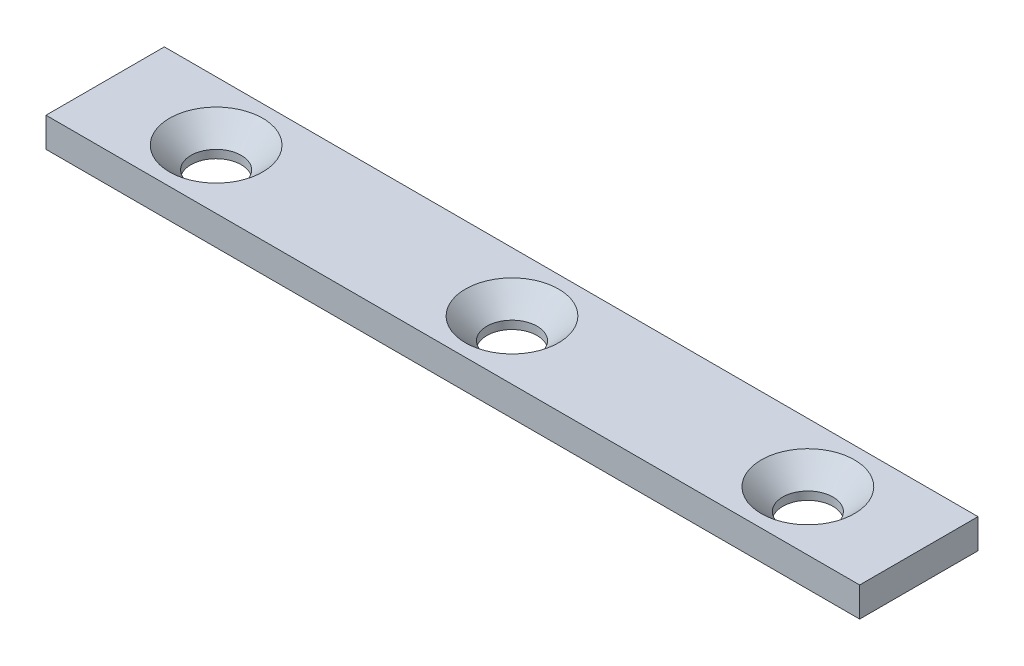
from build123d import *

# Parameters (mm, degrees)
SKETCH1_W           = 55
SKETCH1_H           = 8
BOSS_EXTRUDE1_DEPTH = 2
LPATTERN1_COUNT     = 3
LPATTERN1_PITCH     = 20


with BuildPart() as part:
    # Sketch1 → Boss-Extrude1 (new body)
    with BuildSketch(Plane(origin=(0, 0, 0), x_dir=(1, 0, 0), z_dir=(0, 1, 0))):
        Rectangle(SKETCH1_W, SKETCH1_H)
    extrude(amount=BOSS_EXTRUDE1_DEPTH)

    # Sketch3 → CSK for M3 Countersunk Flat Head1 (revolve, cut)
    with BuildSketch(Plane(origin=(-20, 2, 0), x_dir=(0, 0, 1), z_dir=(1, 0, 0))):
        Polygon((0, 0), (0, 2), (1.7, 2), (1.7, 1.45), (3.15, 0), align=None)
    csk_for_m3_countersunk_flat_head1 = revolve(axis=Axis((-20, 8.35, 0), (0, -1, 0)), mode=Mode.SUBTRACT)

    # LPattern1: CSK for M3 Countersunk Flat Head1 ×3
    with Locations(*[(i * LPATTERN1_PITCH, 0, 0) for i in range(1, LPATTERN1_COUNT)]):
        add(csk_for_m3_countersunk_flat_head1, mode=Mode.SUBTRACT)


solid = part.part
